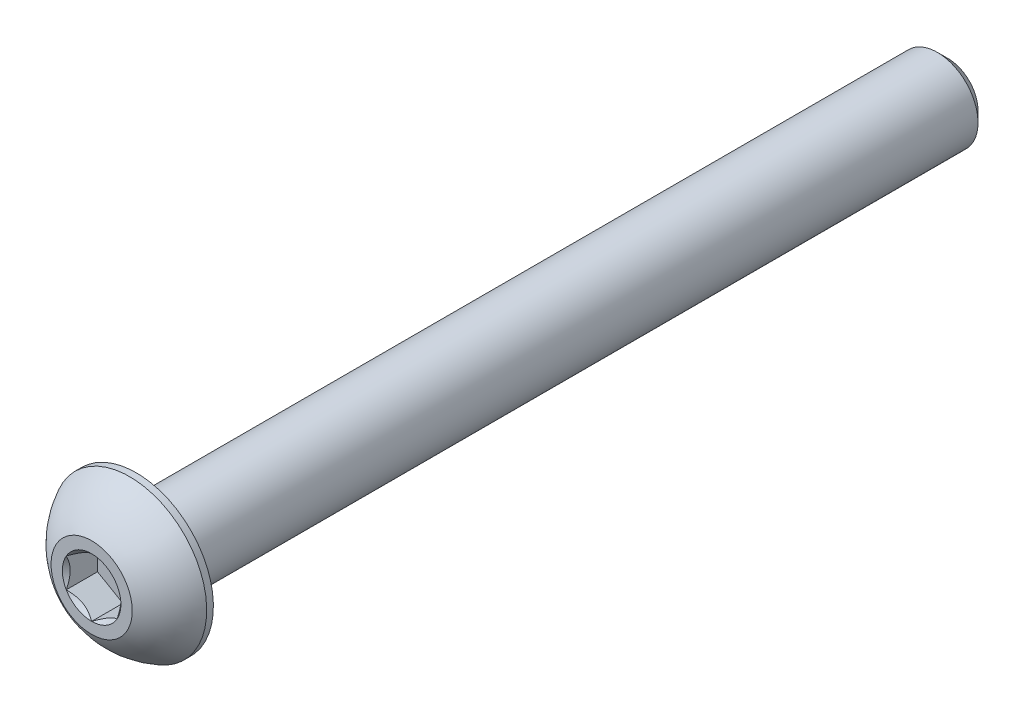
from build123d import *

# Parameters (mm, degrees)
CUT_EXTRUDE2_DEPTH = 1.54


with BuildPart() as part:
    # Sketch10 → Revolve3 (revolve)
    with BuildSketch(Plane(origin=(0, 0, 0), x_dir=(0, 0, -1), z_dir=(1, 0, 0))):
        Polygon((-20, 2), (-20, 0), (20, 0), (20, 1.475), (19.475, 2), align=None)
    revolve(axis=Axis((0, 0, 22.2), (0, 0, -1)))

    # Sketch7 → Revolve2 (revolve)
    with BuildSketch(Plane(origin=(0, 0, 0), x_dir=(0, 0, -1), z_dir=(1, 0, 0))):
        with BuildLine():
            Line((-20.33, 3.8), (-20, 3.8))
            Line((-20, 3.8), (-20, 0))
            Line((-20, 0), (-22.2, 0))
            Line((-22.2, 0), (-22.2, 2))
            ThreePointArc((-22.2, 2), (-21.406499853, 3.047002626), (-20.33, 3.8))
        make_face()
    revolve(axis=Axis((0, 0, 22.2), (0, 0, -1)))

    # Sketch5 → Cut-Extrude2 (cut)
    with BuildSketch(Plane.XY.offset(22.2)):
        Polygon((1.25, -0.721687836), (1.25, 0.721687836), (0, 1.443375673), (-1.25, 0.721687836), (-1.25, -0.721687836), (0, -1.443375673), align=None)
    extrude(amount=-CUT_EXTRUDE2_DEPTH, mode=Mode.SUBTRACT)

    # Cut-Extrude3 cone 1 section (through the dimple's axis) → Cut-Extrude3 (revolve, cut)
    with BuildSketch(Plane(origin=(0, 0, 22.2), x_dir=(0, -1, 0), z_dir=(1, 0, 0))):
        Polygon((0, 0), (1.443375673, 0), (0, 1.443375673), align=None)
    revolve(axis=Axis((0, 0, 22.2), (0, 0, -1)), mode=Mode.SUBTRACT)


solid = part.part
